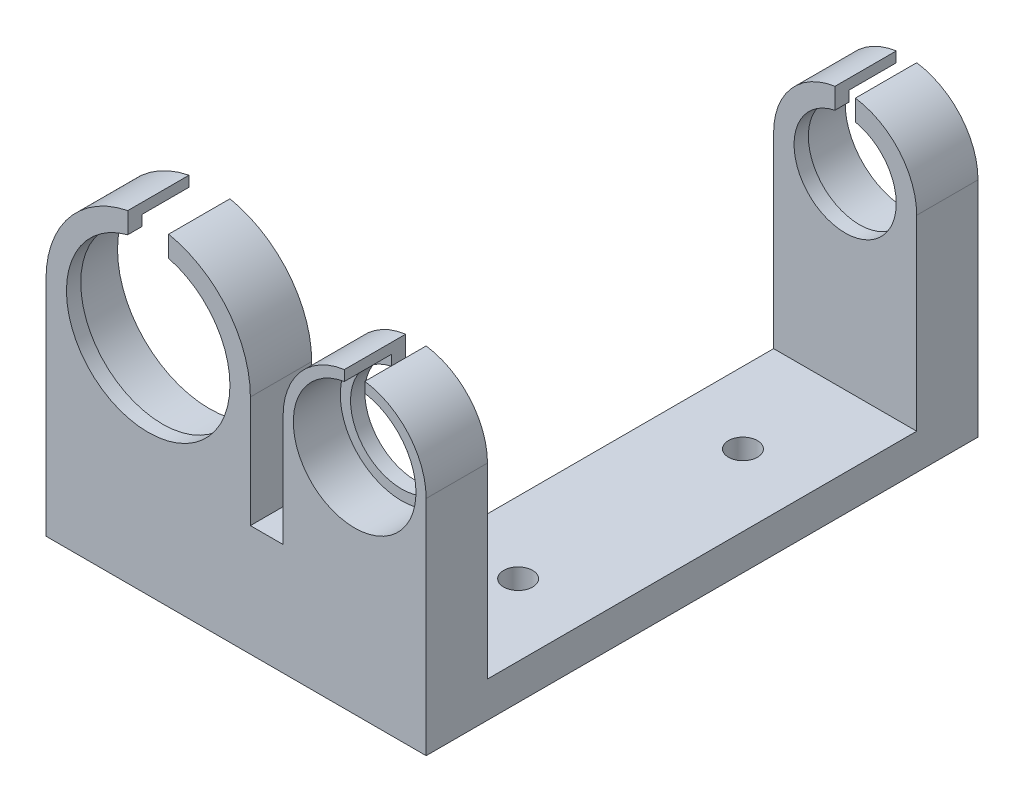
from build123d import *

# Parameters (mm, degrees)
SKETCH1_W                = 4.064
SKETCH1_H                = 13.843
BOSS_EXTRUDE1_DEPTH      = 7.62
BOSS_EXTRUDE2_START      = -1.778
BOSS_EXTRUDE2_DEPTH      = 1.778
BOSS_EXTRUDE3_DEPTH      = 1.778
SKETCH4_W                = 17.78
SKETCH4_H                = 4.445
BOSS_EXTRUDE4_DEPTH      = 60.96
BOSS_EXTRUDE5_START      = -7.62
BOSS_EXTRUDE5_DEPTH      = 7.62
M3_CLEARANCE_HOLE1_D     = 3.6
M3_CLEARANCE_HOLE1_DEPTH = 25.4
M3_CLEARANCE_HOLE1_TIP   = 1.081549114


with BuildPart() as part:
    # Sketch1 → Boss-Extrude1 (new body)
    with BuildSketch(Plane.XY):
        with BuildLine():
            Line((-38.354, -27.686), (-12.954, -27.686))
            Line((-12.954, -27.686), (-12.954, -13.843))
            Line((-12.954, -13.843), (-12.954, 0))
            ThreePointArc((-12.954, 0), (-25.654, -12.7), (-38.354, 0))
            Line((-38.354, 0), (-38.354, -27.686))
        make_face()
        with BuildLine():
            Line((8.89, -27.686), (8.89, 0))
            ThreePointArc((8.89, 0), (0, -8.89), (-8.89, 0))
            Line((-8.89, 0), (-8.89, -13.843))
            Line((-8.89, -13.843), (-8.89, -27.686))
            Line((-8.89, -27.686), (8.89, -27.686))
        make_face()
        with BuildLine():
            ThreePointArc((-8.89, 0), (0, -8.89), (8.89, 0))
            Line((8.89, 0), (7.62, 0))
            ThreePointArc((7.62, 0), (0, -7.62), (-7.62, 0))
            Line((-7.62, 0), (-8.89, 0))
        make_face()
        with BuildLine():
            ThreePointArc((-1.27, 8.798818102), (-6.72020833, 5.819871133), (-8.89, 0))
            Line((-8.89, 0), (-7.62, 0))
            ThreePointArc((-7.62, 0), (-5.819871133, 4.91868885), (-1.27, 7.513421325))
            Line((-1.27, 7.513421325), (-1.27, 8.798818102))
        make_face()
        with BuildLine():
            Line((7.62, 0), (8.89, 0))
            ThreePointArc((8.89, 0), (6.72020833, 5.819871133), (1.27, 8.798818102))
            Line((1.27, 8.798818102), (1.27, 7.513421325))
            ThreePointArc((1.27, 7.513421325), (5.819871133, 4.91868885), (7.62, 0))
        make_face()
        with BuildLine():
            ThreePointArc((-38.354, 0), (-25.654, -12.7), (-12.954, 0))
            Line((-12.954, 0), (-14.224, 0))
            ThreePointArc((-14.224, 0), (-25.654, -11.43), (-37.084, 0))
            Line((-37.084, 0), (-38.354, 0))
        make_face()
        with BuildLine():
            Line((-14.224, 0), (-12.954, 0))
            ThreePointArc((-12.954, 0), (-15.816622301, 8.032185257), (-23.114, 12.443407893))
            Line((-23.114, 12.443407893), (-23.114, 11.144204772))
            ThreePointArc((-23.114, 11.144204772), (-16.718757978, 7.127857322), (-14.224, 0))
        make_face()
        with BuildLine():
            ThreePointArc((-28.194, 12.443407893), (-35.491377699, 8.032185257), (-38.354, 0))
            Line((-38.354, 0), (-37.084, 0))
            ThreePointArc((-37.084, 0), (-34.589242022, 7.127857322), (-28.194, 11.144204772))
            Line((-28.194, 11.144204772), (-28.194, 12.443407893))
        make_face()
        with Locations((-10.922, -20.7645)):
            Rectangle(SKETCH1_W, SKETCH1_H)
    extrude(amount=-BOSS_EXTRUDE1_DEPTH)

    # Sketch2 → Boss-Extrude2 (add)
    with BuildSketch(Plane(origin=(0, 0, -7.62), x_dir=(-1, 0, 0), z_dir=(0, 0, -1)).offset(BOSS_EXTRUDE2_START)):
        with BuildLine():
            Line((-1.27, 6.221703947), (-1.27, 7.513421325))
            ThreePointArc((-1.27, 7.513421325), (-4.91868885, -5.819871133), (7.62, 0))
            ThreePointArc((7.62, 0), (5.819871133, 4.91868885), (1.27, 7.513421325))
            Line((1.27, 7.513421325), (1.27, 6.221703947))
            ThreePointArc((1.27, 6.221703947), (4.91868885, 4.016092628), (6.35, 0))
            ThreePointArc((6.35, 0), (-4.016092628, -4.91868885), (-1.27, 6.221703947))
        make_face()
    boss_extrude2 = extrude(amount=BOSS_EXTRUDE2_DEPTH)

    # Sketch3 → Boss-Extrude3 (add)
    with BuildSketch(Plane.XY):
        with BuildLine():
            Line((-28.194, 9.837377699), (-28.194, 11.144204772))
            ThreePointArc((-28.194, 11.144204772), (-32.781857322, -8.935242022), (-14.224, 0))
            ThreePointArc((-14.224, 0), (-16.718757978, 7.127857322), (-23.114, 11.144204772))
            Line((-23.114, 11.144204772), (-23.114, 9.837377699))
            ThreePointArc((-23.114, 9.837377699), (-17.621814743, 6.221703947), (-15.494, 0))
            ThreePointArc((-15.494, 0), (-31.875703947, -8.032185257), (-28.194, 9.837377699))
        make_face()
    extrude(amount=-BOSS_EXTRUDE3_DEPTH)

    # Sketch4 → Boss-Extrude4 (add)
    with BuildSketch(Plane(origin=(0, 0, -7.62), x_dir=(-1, 0, 0), z_dir=(0, 0, -1))):
        with Locations((0, -25.4635)):
            Rectangle(SKETCH4_W, SKETCH4_H)
    extrude(amount=BOSS_EXTRUDE4_DEPTH)

    # Sketch5 → Boss-Extrude5 (add)
    with BuildSketch(Plane(origin=(0, 0, -68.58), x_dir=(-1, 0, 0), z_dir=(0, 0, -1)).offset(BOSS_EXTRUDE5_START)):
        with BuildLine():
            Line((8.89, -23.241), (8.89, 0))
            ThreePointArc((8.89, 0), (0, -8.89), (-8.89, 0))
            Line((-8.89, 0), (-8.89, -23.241))
            Line((-8.89, -23.241), (8.89, -23.241))
        make_face()
        with BuildLine():
            ThreePointArc((-8.89, 0), (0, -8.89), (8.89, 0))
            ThreePointArc((8.89, 0), (6.72020833, 5.819871133), (1.27, 8.798818102))
            Line((1.27, 8.798818102), (1.27, 7.513421325))
            ThreePointArc((1.27, 7.513421325), (5.819871133, 4.91868885), (7.62, 0))
            ThreePointArc((7.62, 0), (-4.91868885, -5.819871133), (-1.27, 7.513421325))
            Line((-1.27, 7.513421325), (-1.27, 8.798818102))
            ThreePointArc((-1.27, 8.798818102), (-6.72020833, 5.819871133), (-8.89, 0))
        make_face()
    extrude(amount=BOSS_EXTRUDE5_DEPTH)

    # Mirror1: Boss-Extrude2 across plane
    add(boss_extrude2.mirror(Plane(origin=(0, 0, -34.29), x_dir=(1, 0, 0), z_dir=(0, 0, -1))))

    # M3 Clearance Hole1
    with Locations(Plane(origin=(0, -23.241, 0), x_dir=(1, 0, 0), z_dir=(0, 1, 0))):
        with Locations((0, 20.32), (0, 48.26)):
            Hole(M3_CLEARANCE_HOLE1_D / 2, depth=M3_CLEARANCE_HOLE1_DEPTH)
            with Locations((0, 0, -(M3_CLEARANCE_HOLE1_DEPTH + M3_CLEARANCE_HOLE1_TIP / 2))):  # 118° drill point
                Cone(0, M3_CLEARANCE_HOLE1_D / 2, M3_CLEARANCE_HOLE1_TIP, mode=Mode.SUBTRACT)


solid = part.part
